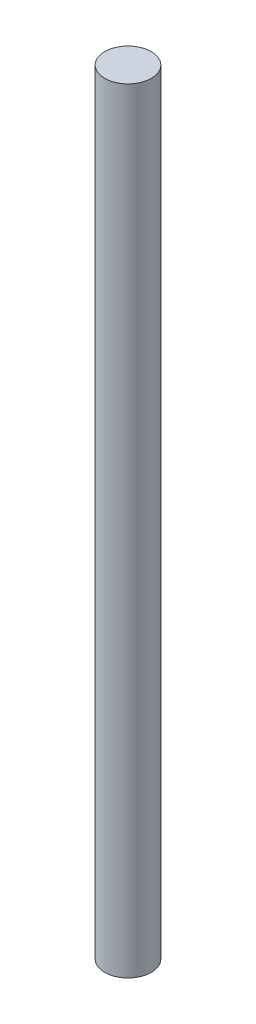
from build123d import *

# Parameters (mm, degrees)
SKETCH2_R           = 4500
BOSS_EXTRUDE1_DEPTH = 150000


with BuildPart() as part:
    # Sketch2 → Boss-Extrude1 (new body)
    with BuildSketch(Plane(origin=(0, 0, 0), x_dir=(1, 0, 0), z_dir=(0, 1, 0))):
        with Locations(Location((0, 0, 0), (0, 0, 270))):
            Circle(SKETCH2_R)
    extrude(amount=BOSS_EXTRUDE1_DEPTH)


solid = part.part
